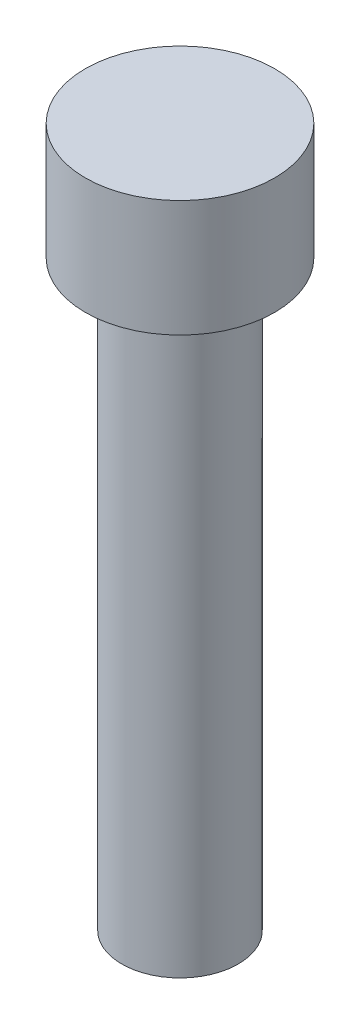
from build123d import *


with BuildPart() as part:
    # Sketch1 → Revolve1 (revolve)
    with BuildSketch(Plane.XY, mode=Mode.PRIVATE) as revolve1_sk:
        Polygon((0, 0), (0, 48), (6.5, 48), (6.5, 40), (4, 40), (4, 0), align=None)
    revolve(revolve1_sk.sketch.rotate(Axis((0, 0, 0), (0, 1, 0)), 90), axis=Axis((0, 0, 0), (0, 1, 0)))


solid = part.part
